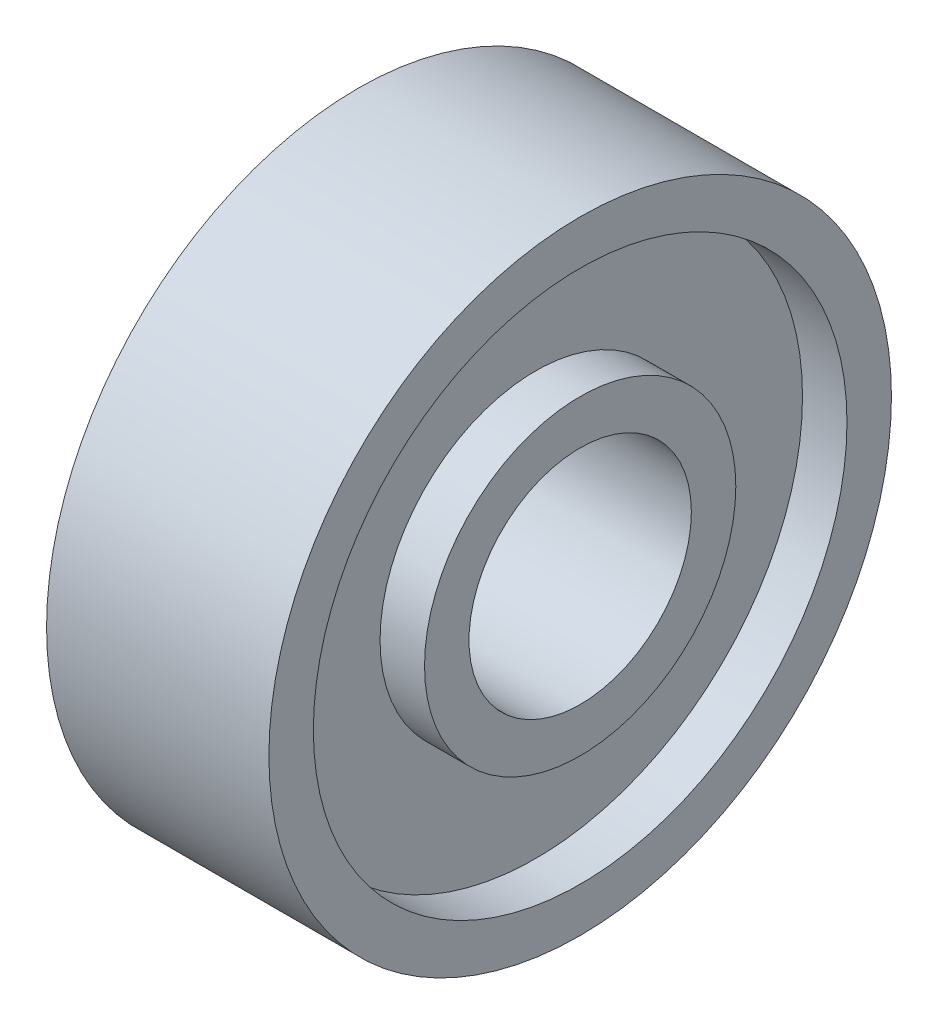
from build123d import *

# Parameters (mm, degrees)
SKETCH_1_R          = 7
SKETCH_1_R_2        = 2.5
EXTRUDE_1_DEPTH     = 2.5
SKETCH_2_R          = 6
SKETCH_2_R_2        = 3.5
CUT_EXTRUDE_1_DEPTH = 1
CUT_EXTRUDE_START   = -1
SKETCH_3_R          = 4.5
SKETCH_3_R_2        = 3.5
CUT_EXTRUDE_2_DEPTH = 1


with BuildPart() as part:
    # 草图1 → 凸台-拉伸1 (new, symmetric)
    with BuildSketch(Plane.YZ):
        with Locations(Location((0, 0, 0), (0, 0, 270))):
            Circle(SKETCH_1_R)
        with Locations(Location((0, 0, 0), (0, 0, 270))):
            Circle(SKETCH_1_R_2, mode=Mode.SUBTRACT)
    extrude(amount=EXTRUDE_1_DEPTH, both=True)

    # 草图2 → 切除-拉伸1 (cut)
    with BuildSketch(Plane(origin=(2.5, 0, 0), x_dir=(0, 0, -1), z_dir=(1, 0, 0))):
        Circle(SKETCH_2_R)
        Circle(SKETCH_2_R_2, mode=Mode.SUBTRACT)
    extrude(amount=-CUT_EXTRUDE_1_DEPTH, mode=Mode.SUBTRACT)

    # 草图3 → 切除-拉伸2 (cut)
    with BuildSketch(Plane.ZY.offset(2.5).offset(CUT_EXTRUDE_START)):
        Circle(SKETCH_3_R)
        with Locations(Location((0, 0, 0), (0, 0, 180))):
            Circle(SKETCH_3_R_2, mode=Mode.SUBTRACT)
    extrude(amount=CUT_EXTRUDE_2_DEPTH, mode=Mode.SUBTRACT)


solid = part.part
